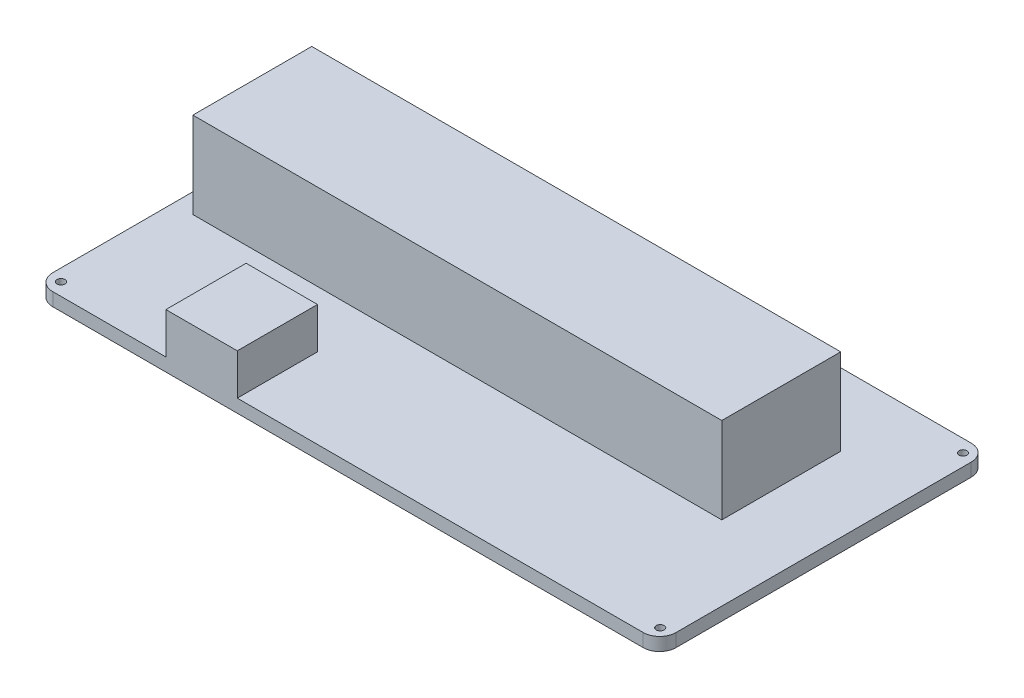
from build123d import *

# Parameters (mm, degrees)
ESQUISSE1_W                                = 76
ESQUISSE1_H                                = 40
BOSS_EXTRU_1_DEPTH                         = 1.6
CONG_1_R                                   = 2
ESQUISSE2_R                                = 0.479748543
ENL_V_MAT_EXTRU_1_DEPTH                    = 1.6
SYM_TRIE1_AT_THE_SECOND_PLANE_COPY_1_SKE_R = 0.479748543
SYM_TRIE1_AT_THE_SECOND_PLANE_COPY_1_DEPTH = 1.6
BOSS_EXTRU_2_DEPTH                         = 10.5
BOSS_EXTRU_2_DEPTH_BACK                    = 3
ESQUISSE3_W                                = 64.5
ESQUISSE3_H                                = 14.5
ESQUISSE4_W                                = 8.707519808
ESQUISSE4_H                                = 9.784752996
BOSS_EXTRU_3_DEPTH                         = 5


with BuildPart() as part:
    # Esquisse1 → Boss.-Extru.1 (new body)
    with BuildSketch(Plane(origin=(0, 0, 0), x_dir=(1, 0, 0), z_dir=(0, 1, 0))):
        Rectangle(ESQUISSE1_W, ESQUISSE1_H)
    extrude(amount=BOSS_EXTRU_1_DEPTH)

    # Congé1
    cong_1_edges = [part.edges().sort_by_distance(p)[0] for p in [
        (38, 0.8, 20),
        (-38, 0.8, 20),
        (-38, 0.8, -20),
        (38, 0.8, -20),
    ]]
    fillet(cong_1_edges, radius=CONG_1_R)

    # Esquisse2 → Enlèv. mat.-Extru.1 (cut)
    with BuildSketch(Plane(origin=(0, 1.6, 0), x_dir=(1, 0, 0), z_dir=(0, 1, 0))):
        with Locations(Location((-36.533901181, -18.459426324, 0), (0, 0, 270))):
            Circle(ESQUISSE2_R)
    enl_v_mat_extru_1 = extrude(amount=-ENL_V_MAT_EXTRU_1_DEPTH, mode=Mode.SUBTRACT)

    # Symétrie1: Enlèv. mat.-Extru.1 across plane
    add(enl_v_mat_extru_1.mirror(Plane(origin=(0, 0, 0), x_dir=(0, 0, 1), z_dir=(1, 0, 0))), mode=Mode.SUBTRACT)

    # Symétrie1 at the second plane: Enlèv. mat.-Extru.1 across plane
    add(enl_v_mat_extru_1.mirror(Plane.XY), mode=Mode.SUBTRACT)

    # Symétrie1 at the second plane copy 1 ske → Symétrie1 at the second plane copy 1 (cut)
    with BuildSketch(Plane(origin=(0, 1.6, 0), x_dir=(-1, 0, 0), z_dir=(0, 1, 0))):
        with Locations(Location((-36.533901181, -18.459426324, 0), (0, 0, 270))):
            Circle(SYM_TRIE1_AT_THE_SECOND_PLANE_COPY_1_SKE_R)
    extrude(amount=-SYM_TRIE1_AT_THE_SECOND_PLANE_COPY_1_DEPTH, mode=Mode.SUBTRACT)

    # Esquisse3 → Boss.-Extru.2 (add, two sides: drawn at the far end of the back side and taken through both)
    with BuildSketch(Plane(origin=(0, 1.6, 0), x_dir=(1, 0, 0), z_dir=(0, 1, 0)).offset(-BOSS_EXTRU_2_DEPTH_BACK)):
        with Locations((-3.35, 3.932898171)):
            Rectangle(ESQUISSE3_W, ESQUISSE3_H)
    extrude(amount=BOSS_EXTRU_2_DEPTH + BOSS_EXTRU_2_DEPTH_BACK)

    # Esquisse4 → Boss.-Extru.3 (add)
    with BuildSketch(Plane(origin=(0, 1.6, 0), x_dir=(1, 0, 0), z_dir=(0, 1, 0))):
        with Locations((-17.853759904, -15.107623502)):
            Rectangle(ESQUISSE4_W, ESQUISSE4_H)
    extrude(amount=BOSS_EXTRU_3_DEPTH)


solid = part.part
